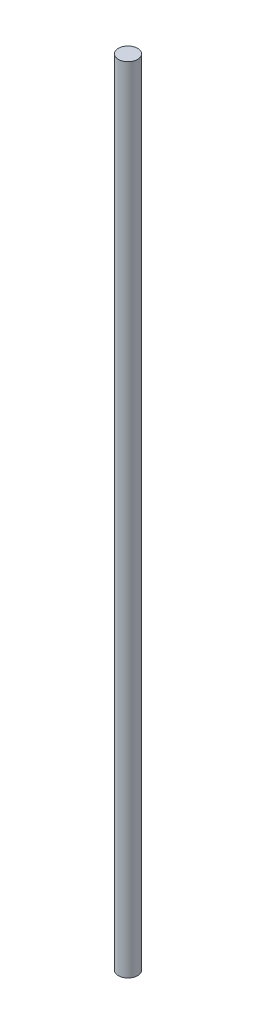
from build123d import *

# Parameters (mm, degrees)
SKETCH1_R           = 4
BOSS_EXTRUDE1_DEPTH = 330


with BuildPart() as part:
    # Sketch1 → Boss-Extrude1 (new body)
    with BuildSketch(Plane(origin=(0, 0, 0), x_dir=(1, 0, 0), z_dir=(0, 1, 0))):
        with Locations(Location((0, 0, 0), (0, 0, 270))):
            Circle(SKETCH1_R)
    extrude(amount=BOSS_EXTRUDE1_DEPTH)


solid = part.part
